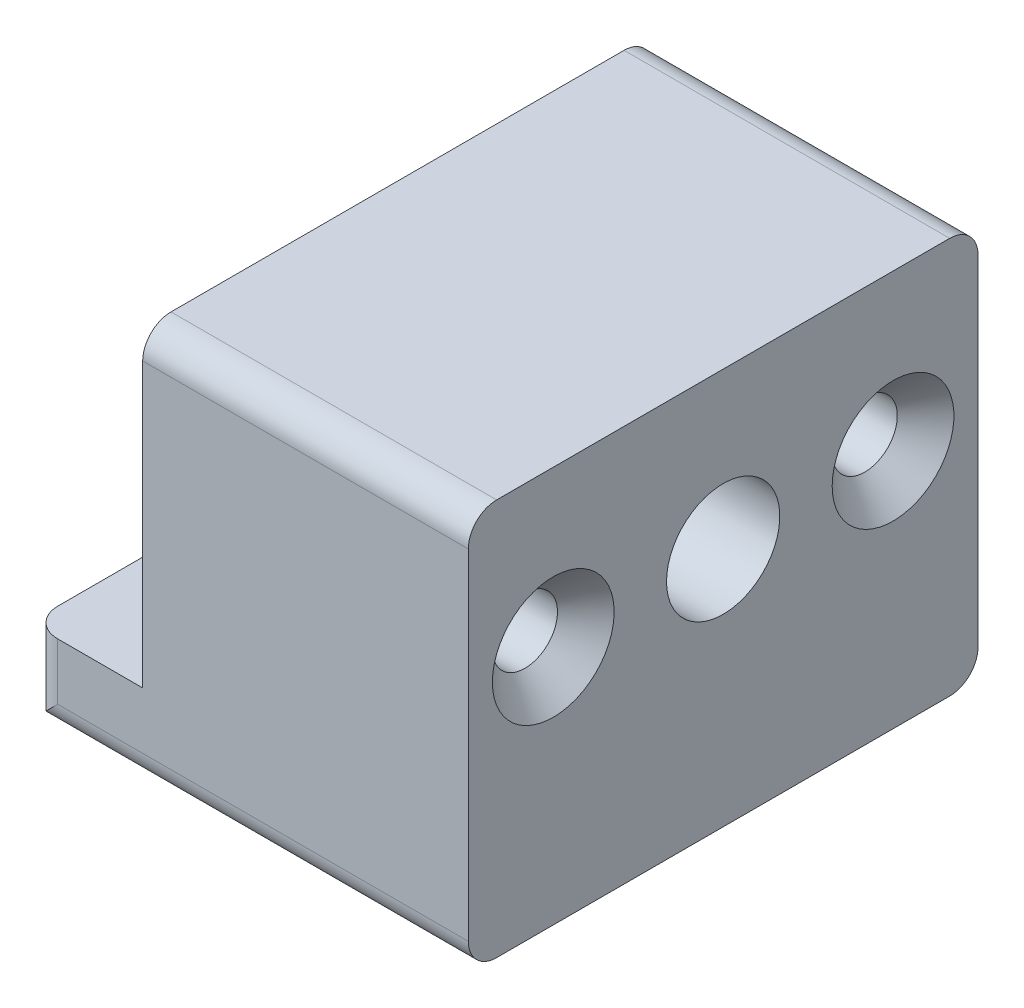
from build123d import *

# Parameters (mm, degrees)
SKETCH_2_W           = 20
SKETCH_2_H           = 14
EXTRUDE_1_DEPTH      = 18
SKETCH_6_R           = 4.4
CUT_EXTRUDE_4_DEPTH  = 1.5
DOME_1_FACE_RADIUS   = 4.4
DOME_1_HEIGHT        = 1
SKETCH_7_W           = 0.5
SKETCH_7_H           = 18
CUT_EXTRUDE_5_DEPTH  = 20
SKETCH_8_W           = 4
SKETCH_8_H           = 18
CUT_EXTRUDE_6_DEPTH  = 27
SKETCH_12_W          = 18
SKETCH_12_H          = 11
CUT_EXTRUDE_9_DEPTH  = 4
SKETCH_13_R          = 2
SKETCH_13_R_2        = 1.15
CUT_EXTRUDE_10_DEPTH = 15.5
SKETCH_14_R          = 4.4
CUT_EXTRUDE_11_DEPTH = 1
CHAMFER_1_SIZE       = 1
FILLET_1_R           = 1


with BuildPart() as part:
    # 草图2 → 凸台-拉伸1 (new body)
    with BuildSketch(Plane.XY):
        Rectangle(SKETCH_2_W, SKETCH_2_H)
    extrude(amount=EXTRUDE_1_DEPTH)

    # 草图6 → 切除-拉伸4 (cut)
    with BuildSketch(Plane.XZ.offset(7)):
        with Locations(Location((0, 9, 0), (0, 0, 270))):
            Circle(SKETCH_6_R)
    extrude(amount=-CUT_EXTRUDE_4_DEPTH, mode=Mode.SUBTRACT)

    # 圆顶1: a dome of height H over a round flat face of radius A is a cap of a sphere of radius (A * A + H * H) / (2 * H)
    dome_1_r = (DOME_1_FACE_RADIUS * DOME_1_FACE_RADIUS + DOME_1_HEIGHT * DOME_1_HEIGHT) / (2 * DOME_1_HEIGHT)
    dome_1_base = Plane((0, -5.5, 9), z_dir=(0, 1, 0))
    with Locations(dome_1_base.offset(DOME_1_HEIGHT - dome_1_r)):
        dome_1_ball = Sphere(dome_1_r, mode=Mode.PRIVATE)
    add(split(dome_1_ball, bisect_by=dome_1_base, keep=Keep.TOP, mode=Mode.PRIVATE), mode=Mode.SUBTRACT)

    # 草图7 → 切除-拉伸5 (cut)
    with BuildSketch(Plane.XZ.offset(7)):
        with Locations((9.75, 9)):
            Rectangle(SKETCH_7_W, SKETCH_7_H)
    extrude(amount=-CUT_EXTRUDE_5_DEPTH, mode=Mode.SUBTRACT)

    # 草图8 → 切除-拉伸6 (cut)
    with BuildSketch(Plane.XZ.offset(7)):
        with Locations((-8, 9)):
            Rectangle(SKETCH_8_W, SKETCH_8_H)
    extrude(amount=-CUT_EXTRUDE_6_DEPTH, mode=Mode.SUBTRACT)

    # 草图12 → 切除-拉伸9 (cut)
    with BuildSketch(Plane.ZY.offset(6)):
        with Locations((9, 1.5)):
            Rectangle(SKETCH_12_W, SKETCH_12_H)
    extrude(amount=-CUT_EXTRUDE_9_DEPTH, mode=Mode.SUBTRACT)

    # 草图13 → 切除-拉伸10 (cut)
    with BuildSketch(Plane.ZY.offset(2)):
        with Locations((9, 1.5)):
            Circle(SKETCH_13_R)
        with Locations((3, 1.5)):
            Circle(SKETCH_13_R_2)
        with Locations((15, 1.5)):
            Circle(SKETCH_13_R_2)
    extrude(amount=-CUT_EXTRUDE_10_DEPTH, mode=Mode.SUBTRACT)

    # 草图14 → 切除-拉伸11 (cut)
    with BuildSketch(Plane.ZY.offset(2)):
        with Locations((9, 1.5)):
            Circle(SKETCH_14_R)
    extrude(amount=-CUT_EXTRUDE_11_DEPTH, mode=Mode.SUBTRACT)

    # 倒角1
    chamfer_1_edges = [part.edges().sort_by_distance(p)[0] for p in [
        (9.5, 1.5, 13.85),
        (9.5, 1.5, 1.85),
    ]]
    chamfer(chamfer_1_edges, length=CHAMFER_1_SIZE)

    # 圆角1
    fillet_1_edges = [part.edges().sort_by_distance(p)[0] for p in [
        (3.75, 7, 0),
        (3.75, 7, 18),
        (1.75, -7, 0),
        (1.75, -7, 18),
        (-6, -5.5, 0),
        (-6, -5.5, 18),
    ]]
    fillet(fillet_1_edges, radius=FILLET_1_R)


solid = part.part
